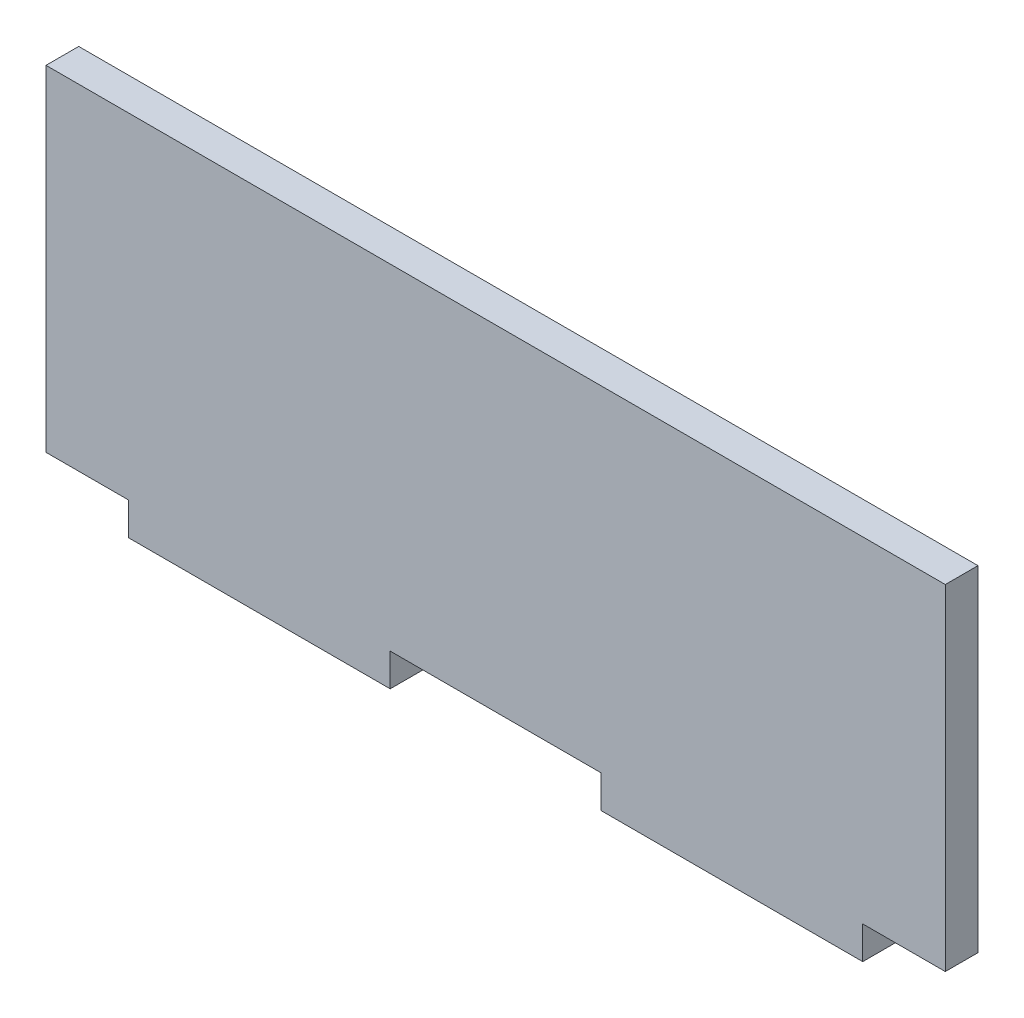
from build123d import *

# Parameters (mm, degrees)
SKETCH1_W           = 55
SKETCH1_H           = 20.5
SKETCH1_W_2         = 16
SKETCH1_H_2         = 2
BOSS_EXTRUDE1_DEPTH = 2


with BuildPart() as part:
    # Sketch1 → Boss-Extrude1 (new body)
    with BuildSketch(Plane.XY):
        Rectangle(SKETCH1_W, SKETCH1_H)
        with Locations((-14.45, -11.25)):
            Rectangle(SKETCH1_W_2, SKETCH1_H_2)
        with Locations((14.45, -11.25)):
            Rectangle(SKETCH1_W_2, SKETCH1_H_2)
    extrude(amount=BOSS_EXTRUDE1_DEPTH)


solid = part.part
